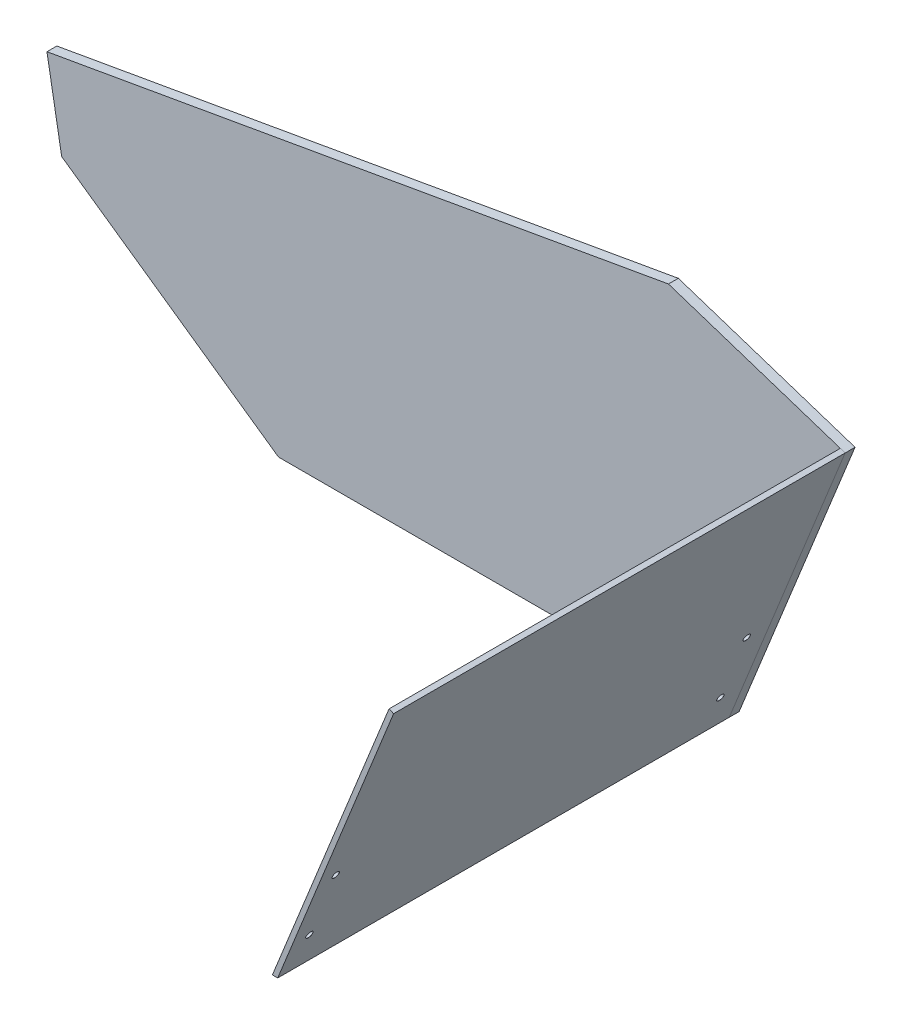
from build123d import *

# Parameters (mm, degrees)
BOSS_EXTRUDE1_DEPTH           = 290
BOSS_EXTRUDE2_DEPTH           = 6.35
M4_CLEARANCE_HOLE1_AT_2_COUNT = 2
M4_CLEARANCE_HOLE1_AT_2_PITCH = 45
M4_CLEARANCE_HOLE1_AT_3_COUNT = 2
M4_CLEARANCE_HOLE1_AT_3_PITCH = 264
M4_CLEARANCE_HOLE1_AT_4_COUNT = 2
M4_CLEARANCE_HOLE1_AT_4_PITCH = 267.807766878


with BuildPart() as part:
    # Sketch1 → Boss-Extrude1 (new body)
    with BuildSketch(Plane.XY):
        Polygon((140, 0), (143.424347808, 0), (217.865127421, 184.247394979), (214.921318683, 185.436770913), align=None)
    extrude(amount=BOSS_EXTRUDE1_DEPTH)

    # Sketch4 → M4 Clearance Hole1 (revolve, cut)
    with BuildSketch(Plane(origin=(169.646809347, 64.90286982, 279), x_dir=(0.3746065934159096, 0.9271838545667884, 0), z_dir=(0, 0, 1))):
        Polygon((0, 0), (0, 489.265093346), (2.25, 489.265093346), (2.25, 0.025), (2.275, 0), align=None)
    m4_clearance_hole1 = revolve(axis=Axis((175.534426824, 62.524117951, 279), (-0.9271838545667884, 0.3746065934159096, 0)), mode=Mode.SUBTRACT)

    # M4 Clearance Hole1 at 2: M4 Clearance Hole1 ×2
    with Locations(*[Vector(-0.3746065934159096, -0.9271838545667884, 0) * (i * M4_CLEARANCE_HOLE1_AT_2_PITCH) for i in range(1, M4_CLEARANCE_HOLE1_AT_2_COUNT)]):
        add(m4_clearance_hole1, mode=Mode.SUBTRACT)

    # M4 Clearance Hole1 at 3: M4 Clearance Hole1 ×2
    with Locations(*[(0, 0, -i * M4_CLEARANCE_HOLE1_AT_3_PITCH) for i in range(1, M4_CLEARANCE_HOLE1_AT_3_COUNT)]):
        add(m4_clearance_hole1, mode=Mode.SUBTRACT)

    # M4 Clearance Hole1 at 4: M4 Clearance Hole1 ×2
    with Locations(*[Vector(-0.06294551087981771, -0.15579560646021043, -0.9857817160344241) * (i * M4_CLEARANCE_HOLE1_AT_4_PITCH) for i in range(1, M4_CLEARANCE_HOLE1_AT_4_COUNT)]):
        add(m4_clearance_hole1, mode=Mode.SUBTRACT)


with BuildPart() as body_2:
    # Sketch2 → Boss-Extrude2 (new body)
    with BuildSketch(Plane.XY):
        Polygon((-294.777867348, 151.108031048), (104.369939009, 221.488558599), (217.865127421, 184.247394979), (143.424347808, 0), (-146.070887152, 0), (-285.326734681, 97.50799418), align=None)
    extrude(amount=-BOSS_EXTRUDE2_DEPTH)


solid = Compound([part.part, body_2.part])
